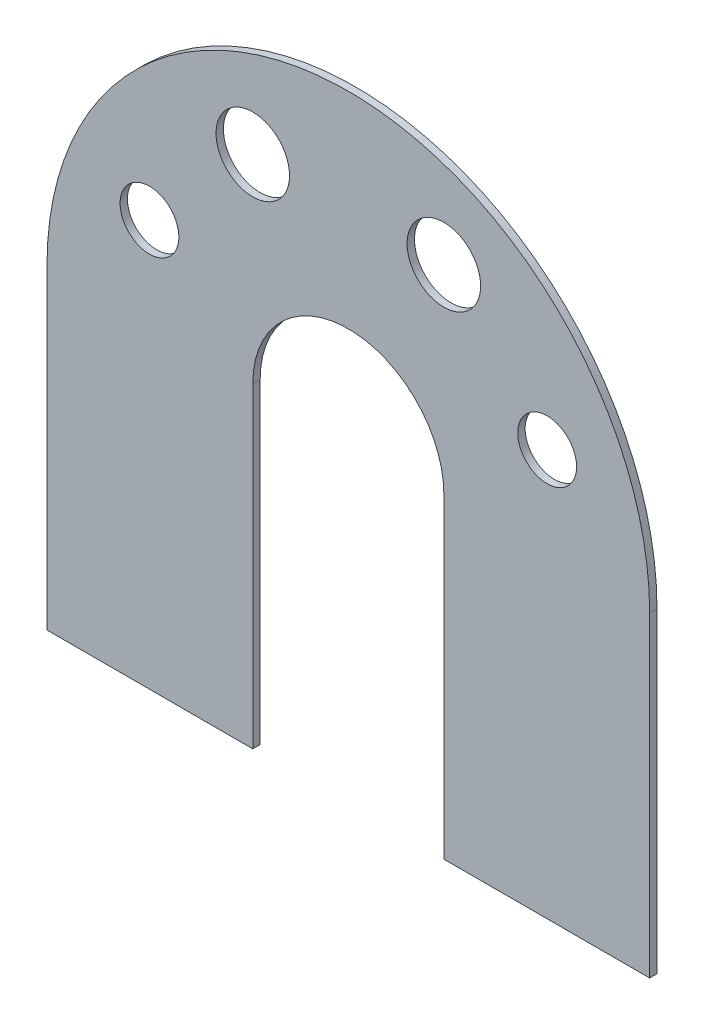
from build123d import *

# Parameters (mm, degrees)
EXTRUDE_1_DEPTH     = 10
SKETCH_3_R          = 50
SKETCH_3_R_2        = 40
CUT_EXTRUDE_3_DEPTH = 50


with BuildPart() as part:
    # 草图1 → 凸台-拉伸1 (new body)
    with BuildSketch(Plane.XY):
        with BuildLine():
            Line((-410, 0), (-410, -430))
            Line((-410, -430), (410, -430))
            Line((410, -430), (410, 0))
            ThreePointArc((410, 0), (0, 410), (-410, 0))
        make_face()
    extrude(amount=EXTRUDE_1_DEPTH)

    # 草图3 → 切除-拉伸3 (cut)
    with BuildSketch(Plane.XY.offset(10)):
        with Locations((-130, 270.438352594)):
            Circle(SKETCH_3_R)
        with Locations((130, 270.438352594)):
            Circle(SKETCH_3_R)
        with Locations((-270.562773315, 122.70173436)):
            Circle(SKETCH_3_R_2)
        with Locations((270.562773315, 122.70173436)):
            Circle(SKETCH_3_R_2)
        with BuildLine():
            Line((-130, 0), (-130, -430))
            Line((-130, -430), (130, -430))
            Line((130, -430), (130, 0))
            ThreePointArc((130, 0), (0, 130), (-130, 0))
        make_face()
    extrude(amount=-CUT_EXTRUDE_3_DEPTH, mode=Mode.SUBTRACT)


solid = part.part
